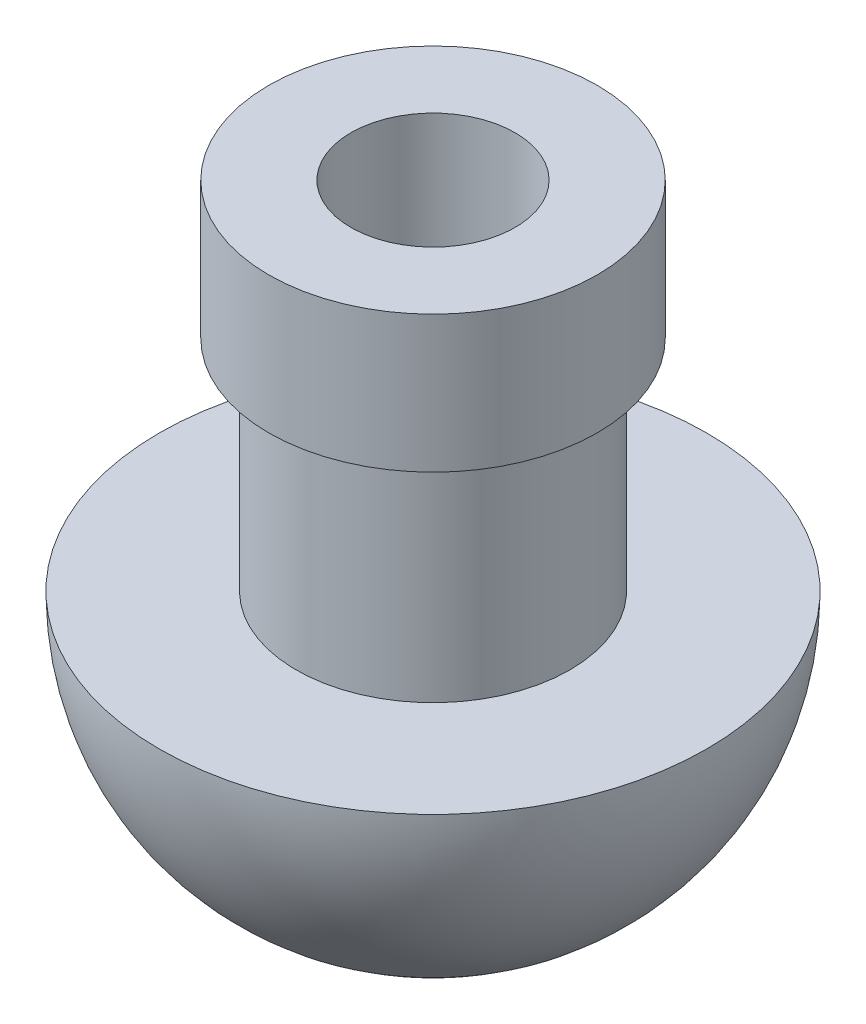
from build123d import *

# Parameters (mm, degrees)
SZKIC2_R                   = 3
WYTNIJ_WYCI_GNI_CIE1_DEPTH = 13


with BuildPart() as part:
    # Szkic1 → Obrót5 (revolve)
    with BuildSketch(Plane.XY, mode=Mode.PRIVATE) as obr_t5_sk:
        with BuildLine():
            Line((-10, 0), (-5, 0))
            Line((-5, 0), (-5, 8))
            Line((-5, 8), (-6, 8))
            Line((-6, 8), (-6, 13))
            Line((-6, 13), (0, 13))
            Line((0, 13), (0, 0))
            Line((0, 0), (0, -10))
            ThreePointArc((0, -10), (-7.071067812, -7.071067812), (-10, 0))
        make_face()
    revolve(obr_t5_sk.sketch.rotate(Axis((0, -10, 0), (0, 1, 0)), 180), axis=Axis((0, -10, 0), (0, 1, 0)))

    # Szkic2 → Wytnij-wyciągnięcie1 (cut)
    with BuildSketch(Plane(origin=(0, 13, 0), x_dir=(1, 0, 0), z_dir=(0, 1, 0))):
        with Locations(Location((0, 0, 0), (0, 0, 180))):
            Circle(SZKIC2_R)
    extrude(amount=-WYTNIJ_WYCI_GNI_CIE1_DEPTH, mode=Mode.SUBTRACT)


solid = part.part
